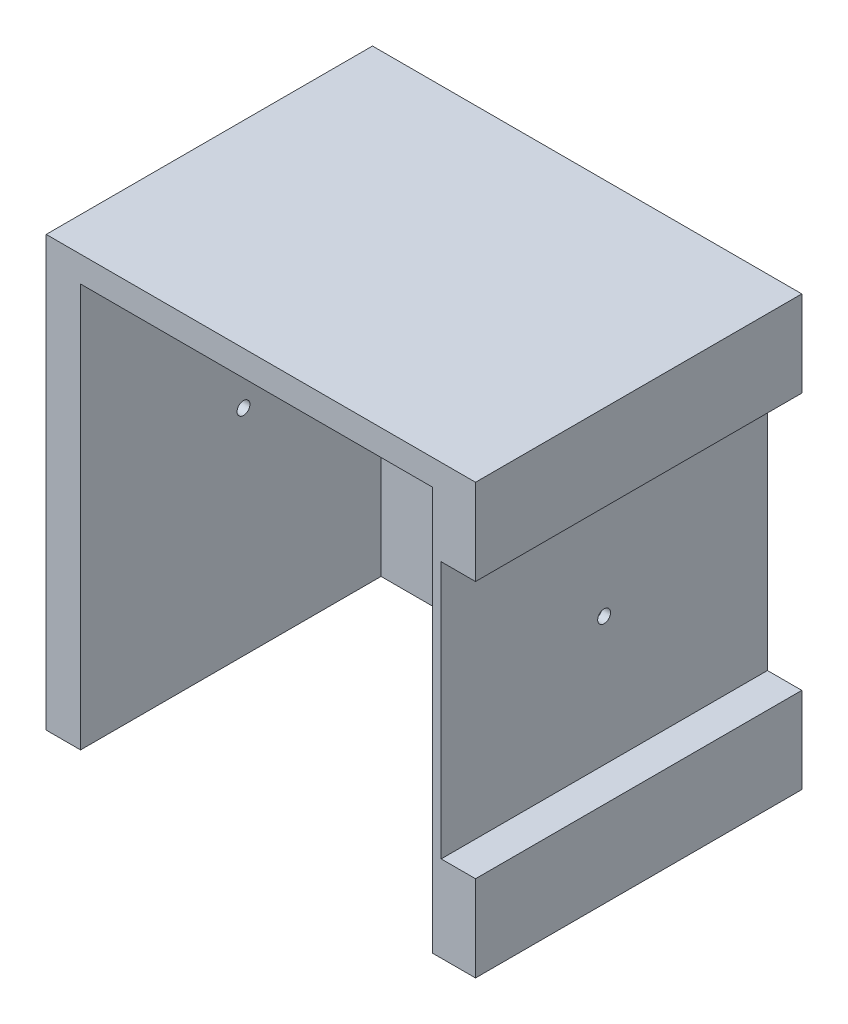
from build123d import *

# Parameters (mm, degrees)
SKETCH8_W            = 50
SKETCH8_H            = 50
BOSS_EXTRUDE7_DEPTH  = 3
SKETCH9_W            = 38
SKETCH9_H            = 50
BOSS_EXTRUDE8_DEPTH  = 5
SKETCH10_W           = 38
SKETCH10_H           = 50
BOSS_EXTRUDE9_DEPTH  = 4
SKETCH11_W           = 50
SKETCH11_H           = 38
BOSS_EXTRUDE10_DEPTH = 3
SKETCH13_W           = 38
SKETCH13_H           = 29.975664986
CUT_EXTRUDE1_DEPTH   = 4
SKETCH14_R           = 0.75
CUT_EXTRUDE3_DEPTH   = 68


with BuildPart() as part:
    # Sketch8 → Boss-Extrude7 (new body)
    with BuildSketch(Plane.XY):
        Rectangle(SKETCH8_W, SKETCH8_H)
    extrude(amount=BOSS_EXTRUDE7_DEPTH)

    # Sketch9 → Boss-Extrude8 (add)
    with BuildSketch(Plane(origin=(25, 0, 0), x_dir=(0, 0, -1), z_dir=(1, 0, 0))):
        with Locations((-19, 0)):
            Rectangle(SKETCH9_W, SKETCH9_H)
    extrude(amount=-BOSS_EXTRUDE8_DEPTH)

    # Sketch10 → Boss-Extrude9 (add)
    with BuildSketch(Plane.ZY.offset(25)):
        with Locations((19, 0)):
            Rectangle(SKETCH10_W, SKETCH10_H)
    extrude(amount=-BOSS_EXTRUDE9_DEPTH)

    # Sketch11 → Boss-Extrude10 (add)
    with BuildSketch(Plane(origin=(0, 25, 0), x_dir=(1, 0, 0), z_dir=(0, 1, 0))):
        with Locations((0, -19)):
            Rectangle(SKETCH11_W, SKETCH11_H)
    extrude(amount=-BOSS_EXTRUDE10_DEPTH)

    # Sketch13 → Cut-Extrude1 (cut)
    with BuildSketch(Plane(origin=(25, 0, 0), x_dir=(0, 0, -1), z_dir=(1, 0, 0))):
        with Locations((-19, 0)):
            Rectangle(SKETCH13_W, SKETCH13_H)
    extrude(amount=-CUT_EXTRUDE1_DEPTH, mode=Mode.SUBTRACT)

    # Sketch14 → Cut-Extrude3 (cut)
    with BuildSketch(Plane.ZY.offset(25)):
        with Locations(Location((19.021319819, 0, 0), (0, 0, 270))):
            Circle(SKETCH14_R)
    extrude(amount=-CUT_EXTRUDE3_DEPTH, mode=Mode.SUBTRACT)


solid = part.part
